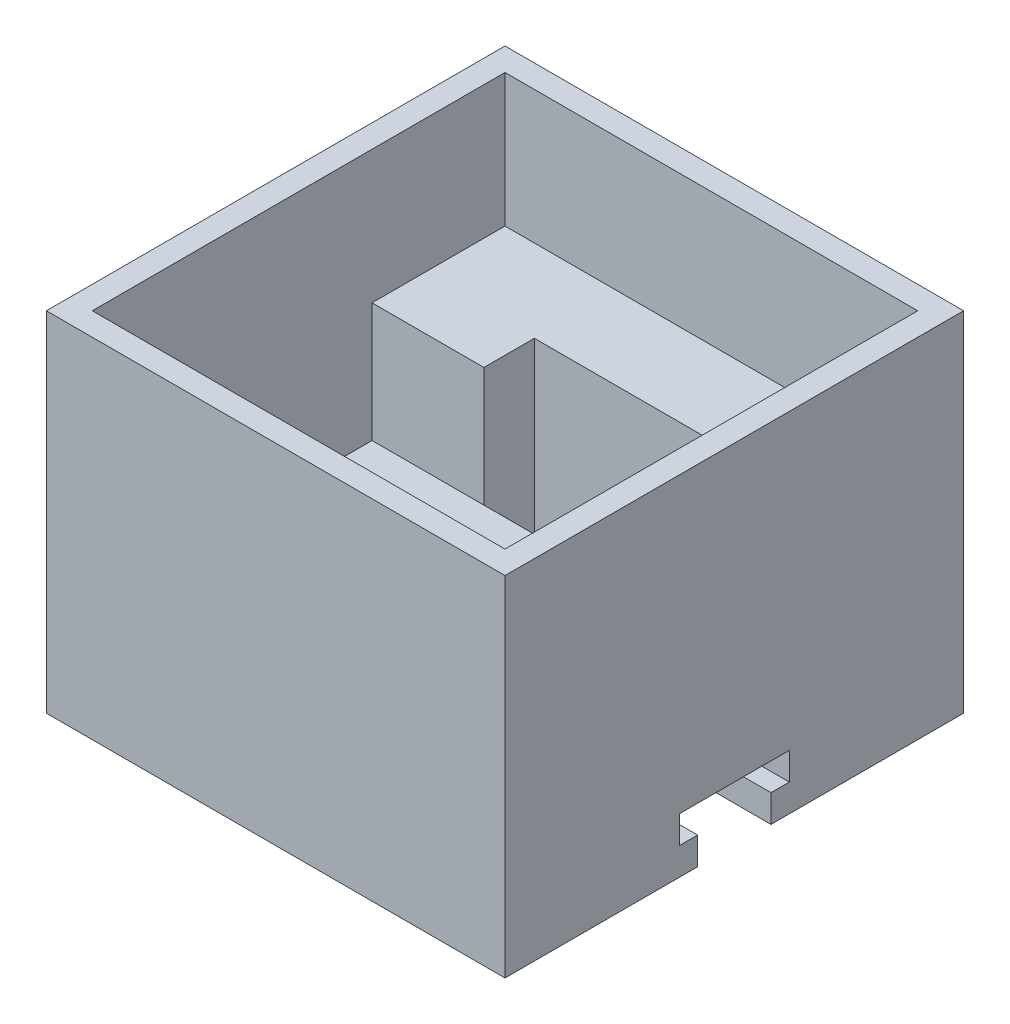
from build123d import *

# Parameters (mm, degrees)
SKETCH1_W             = 50
SKETCH1_H             = 50
BOSS_EXTRUDE1_DEPTH   = 38
SHELL1_T              = -2.5
BOSS_EXTRUDE2_DEPTH   = 21
BOSS_EXTRUDE2_2_DEPTH = 21
SKETCH3_W             = 45
SKETCH3_H             = 16
BOSS_EXTRUDE3_DEPTH   = 8
SKETCH4_W             = 32.5
SKETCH4_H             = 8
CUT_EXTRUDE1_DEPTH    = 3
SKETCH7_W             = 32.5
SKETCH7_H             = 12
CUT_EXTRUDE2_DEPTH    = 3


with BuildPart() as part:
    # Sketch1 → Boss-Extrude1 (new body)
    with BuildSketch(Plane(origin=(0, 0, 0), x_dir=(1, 0, 0), z_dir=(0, 1, 0))):
        Rectangle(SKETCH1_W, SKETCH1_H)
    extrude(amount=BOSS_EXTRUDE1_DEPTH)

    # Shell1
    shell1_openings = [part.faces().sort_by_distance(p)[0] for p in [
        (0, 38, 0),
    ]]
    offset(amount=SHELL1_T, openings=shell1_openings, kind=Kind.INTERSECTION)

    # Sketch3 → Boss-Extrude3 (add)
    with BuildSketch(Plane(origin=(0, 2.5, 0), x_dir=(1, 0, 0), z_dir=(0, 1, 0))):
        Rectangle(SKETCH3_W, SKETCH3_H)
    extrude(amount=BOSS_EXTRUDE3_DEPTH)

    # Sketch4 → Cut-Extrude1 (cut)
    with BuildSketch(Plane.XZ):
        with Locations((8.75, 0)):
            Rectangle(SKETCH4_W, SKETCH4_H)
    extrude(amount=-CUT_EXTRUDE1_DEPTH, mode=Mode.SUBTRACT)

    # Sketch7 → Cut-Extrude2 (cut)
    with BuildSketch(Plane(origin=(0, 3, 0), x_dir=(-1, 0, 0), z_dir=(0, -1, 0))):
        with Locations((-8.75, 0)):
            Rectangle(SKETCH7_W, SKETCH7_H)
    extrude(amount=-CUT_EXTRUDE2_DEPTH, mode=Mode.SUBTRACT)


with BuildPart() as body_2:
    # Sketch2 → Boss-Extrude2 (new body)
    with BuildSketch(Plane(origin=(0, 2.5, 0), x_dir=(1, 0, 0), z_dir=(0, 1, 0))):
        Polygon((-10.3, -13.6), (-22.5, -13.6), (-22.5, -22.5), (0.190053949, -22.5), (22.5, -22.5), (22.5, -13.6), (10.3, -13.6), (10.3, -20.79), (0.190053949, -20.79), (-10.3, -20.79), align=None)
    extrude(amount=BOSS_EXTRUDE2_DEPTH)


with BuildPart() as body_3:
    # Sketch2 → Boss-Extrude2 2 (new body)
    with BuildSketch(Plane(origin=(0, 2.5, 0), x_dir=(1, 0, 0), z_dir=(0, 1, 0))):
        Polygon((-22.5, 8), (-10.3, 8), (-10.3, 13.5), (0, 13.5), (10.3, 13.5), (10.3, 8), (22.5, 8), (22.5, 22.5), (0, 22.5), (-22.5, 22.5), align=None)
    extrude(amount=BOSS_EXTRUDE2_2_DEPTH)


solid = Compound([part.part, body_2.part, body_3.part])
